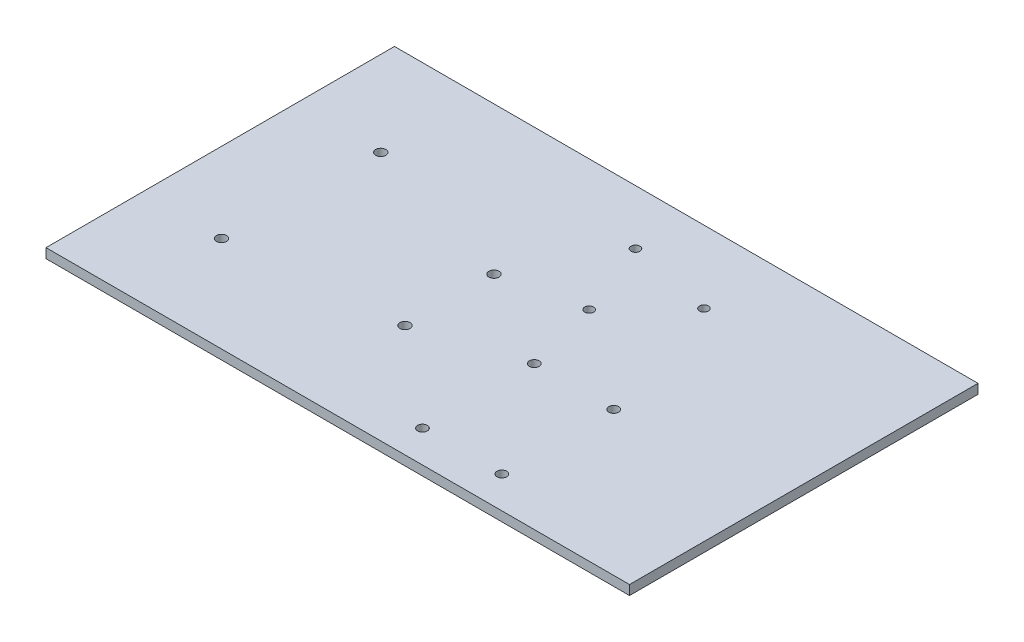
from build123d import *

# Parameters (mm, degrees)
SKETCH1_W           = 182.88
SKETCH1_H           = 109.22
BOSS_EXTRUDE1_DEPTH = 3
SKETCH2_R           = 1.6
CUT_EXTRUDE1_DEPTH  = 10
SKETCH3_R           = 1.3999972
CUT_EXTRUDE2_DEPTH  = 107.548231801
SKETCH4_R           = 1.525
CUT_EXTRUDE3_DEPTH  = 107.548231801


with BuildPart() as part:
    # Sketch1 → Boss-Extrude1 (new body)
    with BuildSketch(Plane(origin=(0, 0, 0), x_dir=(1, 0, 0), z_dir=(0, 1, 0))):
        Rectangle(SKETCH1_W, SKETCH1_H)
    extrude(amount=BOSS_EXTRUDE1_DEPTH)

    # Sketch2 → Cut-Extrude1 (cut)
    with BuildSketch(Plane(origin=(0, 3, 0), x_dir=(1, 0, 0), z_dir=(0, 1, 0))):
        with Locations(Location((-66.44, -24.61, 0), (0, 0, 270))):
            Circle(SKETCH2_R)
        with Locations(Location((-64.84, 23.69, 0), (0, 0, 270))):
            Circle(SKETCH2_R)
        with Locations(Location((-14.04, 8.39, 0), (0, 0, 270))):
            Circle(SKETCH2_R)
        with Locations(Location((-14.04, -19.51, 0), (0, 0, 270))):
            Circle(SKETCH2_R)
    extrude(amount=-CUT_EXTRUDE1_DEPTH, mode=Mode.SUBTRACT)

    # Sketch3 → Cut-Extrude2 (cut, through all)
    with BuildSketch(Plane(origin=(0, 3, 0), x_dir=(1, 0, 0), z_dir=(0, 1, 0))):
        with Locations(Location((10.495430786, 13.69, 0), (0, 0, 270))):
            Circle(SKETCH3_R)
        with Locations(Location((1.233573521, 37.47, 0), (0, 0, 270))):
            Circle(SKETCH3_R)
        with Locations(Location((28.18, 31.98, 0), (0, 0, 270))):
            Circle(SKETCH3_R)
    extrude(amount=-CUT_EXTRUDE2_DEPTH, mode=Mode.SUBTRACT)

    # Sketch4 → Cut-Extrude3 (cut, through all)
    with BuildSketch(Plane(origin=(0, 3, 0), x_dir=(1, 0, 0), z_dir=(0, 1, 0))):
        with Locations(Location((16.55, -44.61, 0), (0, 0, 270))):
            Circle(SKETCH4_R)
        with Locations(Location((41.44, -9.56, 0), (0, 0, 270))):
            Circle(SKETCH4_R)
        with Locations(Location((16.55, -9.56, 0), (0, 0, 270))):
            Circle(SKETCH4_R)
        with Locations(Location((41.44, -44.61, 0), (0, 0, 270))):
            Circle(SKETCH4_R)
    extrude(amount=-CUT_EXTRUDE3_DEPTH, mode=Mode.SUBTRACT)


solid = part.part
